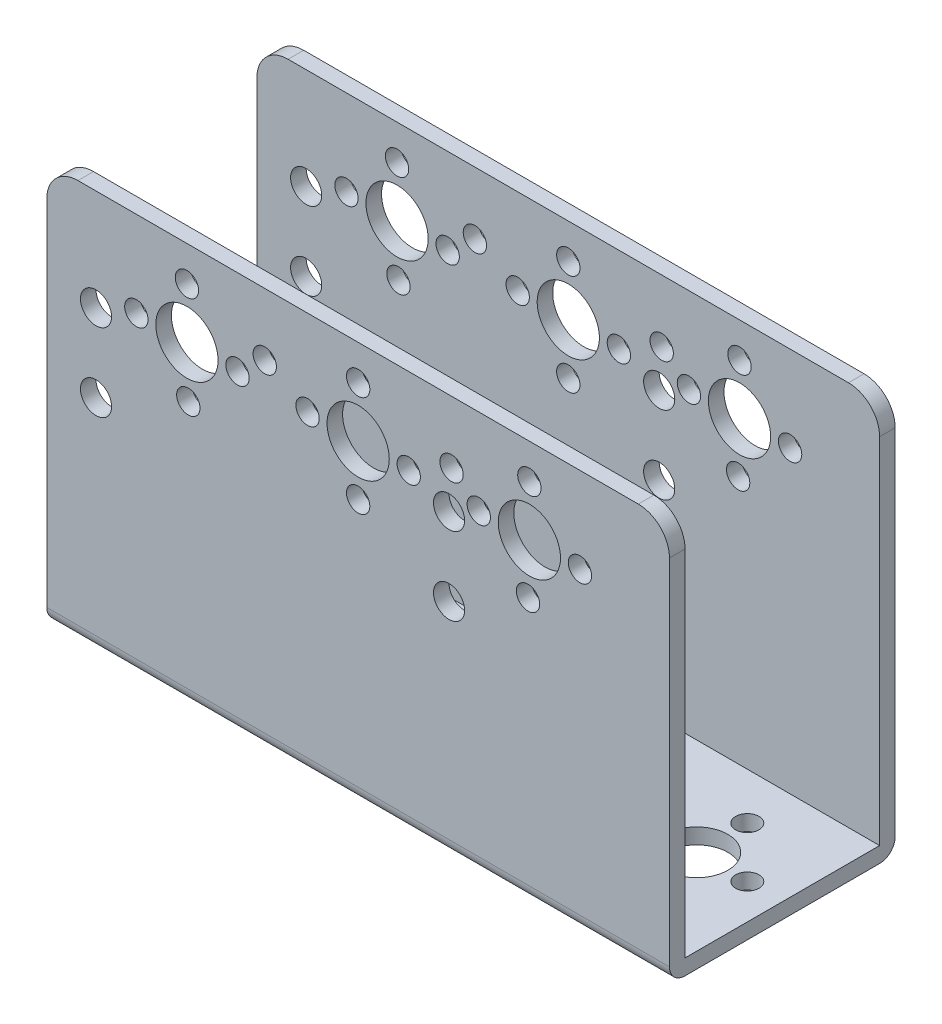
from build123d import *

# Parameters (mm, degrees)
SKETCH1_W           = 80
SKETCH1_H           = 29
BOSS_EXTRUDE1_DEPTH = 51.5
SKETCH2_W           = 25
SKETCH2_H           = 49.5
CUT_EXTRUDE1_DEPTH  = 100.464817901
FILLET6_R           = 2
SKETCH3_R           = 1.5
SKETCH3_R_2         = 4
CUT_EXTRUDE2_DEPTH  = 43.5
SKETCH4_R           = 4
SKETCH4_R_2         = 1.5
SKETCH4_R_3         = 2
CUT_EXTRUDE3_DEPTH  = 43.5
FILLET7_R           = 4


with BuildPart() as part:
    # Sketch1 → Boss-Extrude1 (new body)
    with BuildSketch(Plane(origin=(0, 0, 0), x_dir=(1, 0, 0), z_dir=(0, 1, 0))):
        with Locations((0, -14.5)):
            Rectangle(SKETCH1_W, SKETCH1_H)
    extrude(amount=BOSS_EXTRUDE1_DEPTH)

    # Sketch2 → Cut-Extrude1 (cut, through all)
    with BuildSketch(Plane(origin=(40, 0, 0), x_dir=(0, 0, -1), z_dir=(1, 0, 0))):
        with Locations((-14.5, 26.75)):
            Rectangle(SKETCH2_W, SKETCH2_H)
    extrude(amount=-CUT_EXTRUDE1_DEPTH, mode=Mode.SUBTRACT)

    # Fillet6
    fillet6_edges = [part.edges().sort_by_distance(p)[0] for p in [
        (0, 0, 0),
        (0, 0, 29),
    ]]
    fillet(fillet6_edges, radius=FILLET6_R)

    # Sketch3 → Cut-Extrude2 (cut)
    with BuildSketch(Plane(origin=(0, 2, 0), x_dir=(1, 0, 0), z_dir=(0, 1, 0))):
        with Locations(Location((35.5, -14.5, 0), (0, 0, 270))):
            Circle(SKETCH3_R)
        with Locations(Location((29, -14.5, 0), (0, 0, 270))):
            Circle(SKETCH3_R_2)
        with Locations(Location((22.5, -14.5, 0), (0, 0, 270))):
            Circle(SKETCH3_R)
        with Locations(Location((29, -8, 0), (0, 0, 270))):
            Circle(SKETCH3_R)
        with Locations(Location((29, -21, 0), (0, 0, 270))):
            Circle(SKETCH3_R)
        with Locations(Location((-29, -21, 0), (0, 0, 90))):
            Circle(SKETCH3_R)
        with Locations(Location((-35.5, -14.5, 0), (0, 0, 90))):
            Circle(SKETCH3_R)
        with Locations(Location((-22.5, -14.5, 0), (0, 0, 90))):
            Circle(SKETCH3_R)
        with Locations(Location((-29, -14.5, 0), (0, 0, 90))):
            Circle(SKETCH3_R_2)
        with Locations(Location((-29, -8, 0), (0, 0, 90))):
            Circle(SKETCH3_R)
        with Locations(Location((0, -14.5, 0), (0, 0, 270))):
            Circle(SKETCH3_R_2)
        with Locations(Location((6.5, -14.5, 0), (0, 0, 270))):
            Circle(SKETCH3_R)
        with Locations(Location((-6.5, -14.5, 0), (0, 0, 270))):
            Circle(SKETCH3_R)
        with Locations(Location((0, -8, 0), (0, 0, 270))):
            Circle(SKETCH3_R)
        with Locations(Location((0, -21, 0), (0, 0, 270))):
            Circle(SKETCH3_R)
    extrude(amount=-CUT_EXTRUDE2_DEPTH, mode=Mode.SUBTRACT)

    # Sketch4 → Cut-Extrude3 (cut)
    with BuildSketch(Plane.XY.offset(29)):
        with Locations((22, 40.5)):
            Circle(SKETCH4_R)
        with Locations((15.5, 40.5)):
            Circle(SKETCH4_R_2)
        with Locations((28.5, 40.5)):
            Circle(SKETCH4_R_2)
        with Locations((22, 47)):
            Circle(SKETCH4_R_2)
        with Locations((21.823366501, 34)):
            Circle(SKETCH4_R_2)
        with Locations((-21.823366501, 34)):
            Circle(SKETCH4_R_2)
        with Locations((-28.5, 40.5)):
            Circle(SKETCH4_R_2)
        with Locations((-22, 47)):
            Circle(SKETCH4_R_2)
        with Locations((-22, 40.5)):
            Circle(SKETCH4_R)
        with Locations((-15.5, 40.5)):
            Circle(SKETCH4_R_2)
        with Locations((0, 40.5)):
            Circle(SKETCH4_R)
        with Locations((6.5, 40.5)):
            Circle(SKETCH4_R_2)
        with Locations((-6.5, 40.5)):
            Circle(SKETCH4_R_2)
        with Locations((0, 47)):
            Circle(SKETCH4_R_2)
        with Locations((0, 34)):
            Circle(SKETCH4_R_2)
        with Locations((12, 43.5)):
            Circle(SKETCH4_R_2)
        with Locations((-12, 43.5)):
            Circle(SKETCH4_R_2)
        with Locations((11.68, 38.5)):
            Circle(SKETCH4_R_3)
        with Locations((11.68, 28.5)):
            Circle(SKETCH4_R_3)
        with Locations((-33.68, 38.5)):
            Circle(SKETCH4_R_3)
        with Locations((-33.68, 28.5)):
            Circle(SKETCH4_R_3)
    extrude(amount=-CUT_EXTRUDE3_DEPTH, mode=Mode.SUBTRACT)

    # Fillet7
    fillet7_edges = [part.edges().sort_by_distance(p)[0] for p in [
        (40, 51.5, 28),
        (-40, 51.5, 28),
        (40, 51.5, 1),
        (-40, 51.5, 1),
    ]]
    fillet(fillet7_edges, radius=FILLET7_R)


solid = part.part
